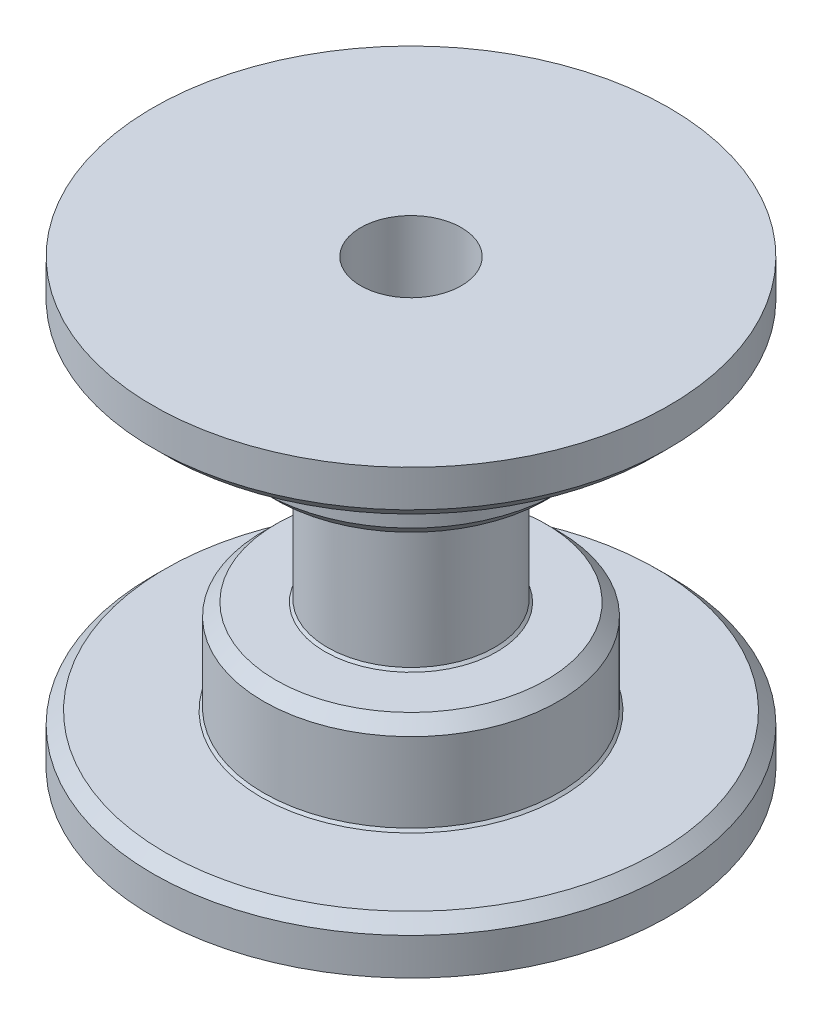
from build123d import *

# Parameters (mm, degrees)
CHAMFER1_SIZE = 1
CHAMFER2_SIZE = 0.2


with BuildPart() as part:
    # Sketch1 → Revolve1 (revolve)
    with BuildSketch(Plane(origin=(0, 0, 0), x_dir=(0, 0, -1), z_dir=(1, 0, 0))):
        Polygon((4.1, 18), (21, 18), (21, 14), (12, 14), (12, 6.35), (6.8, 6.35), (6.8, -6.35), (12, -6.35), (12, -14), (21, -14), (21, -18), (4.1, -18), align=None)
    revolve(axis=Axis((0, -56.19047619, 0), (0, 1, 0)))

    # Chamfer1
    chamfer1_edges = [part.edges().sort_by_distance(p)[0] for p in [
        (0, -14, 21),
        (0, 14, 21),
        (0, 6.35, 12),
        (0, -6.35, 12),
    ]]
    chamfer(chamfer1_edges, length=CHAMFER1_SIZE)

    # Chamfer2
    chamfer2_edges = [part.edges().sort_by_distance(p)[0] for p in [
        (0, 14, 12),
        (0, 6.35, 6.8),
        (0, -6.35, 6.8),
        (0, -14, 12),
    ]]
    chamfer(chamfer2_edges, length=CHAMFER2_SIZE)


solid = part.part
